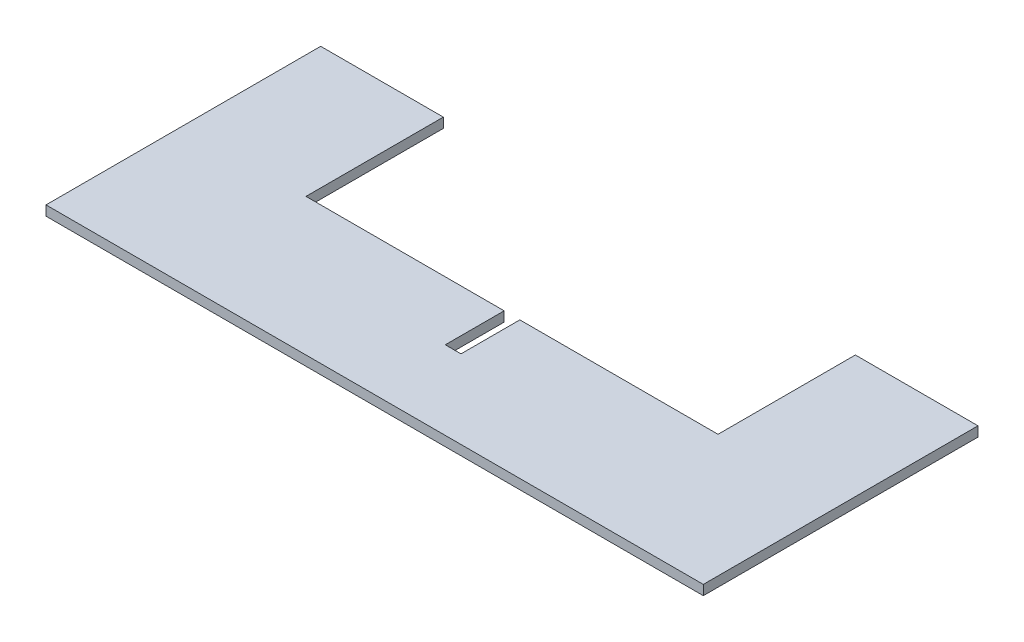
from build123d import *

# Parameters (mm, degrees)
SALIENTE_EXTRUIR1_DEPTH = 0.5


with BuildPart() as part:
    # Croquis1 → Saliente-Extruir1 (new body)
    with BuildSketch(Plane(origin=(0, 0, 0), x_dir=(1, 0, 0), z_dir=(0, 1, 0))):
        Polygon((0, 0), (33.5, 0), (33.5, 14), (27.25, 14), (27.25, 7), (17.15, 7), (17.15, 4), (16.35, 4), (16.35, 7), (6.25, 7), (6.25, 14), (0, 14), align=None)
    extrude(amount=SALIENTE_EXTRUIR1_DEPTH)


solid = part.part
